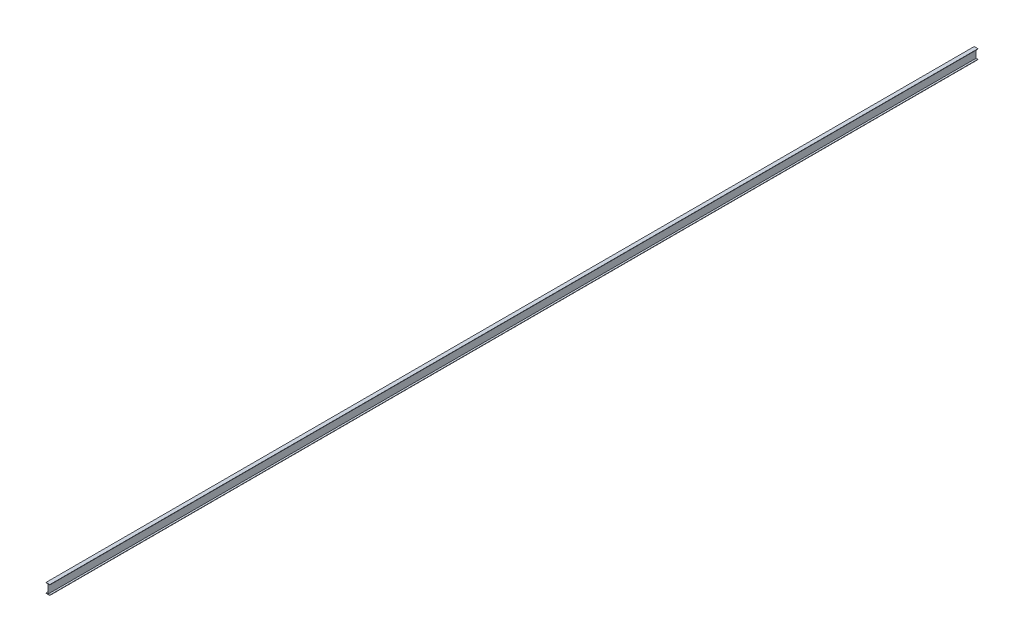
from build123d import *

# Parameters (mm, degrees)
BOSS_EXTRUDE1_DEPTH = 49152


with BuildPart() as part:
    # Sketch1 → Boss-Extrude1 (new body)
    with BuildSketch(Plane.XY):
        Polygon((100, 0), (100, 16), (5.1, 16), (5.1, 484.000003206), (100, 484.0000061), (100, 500), (-100, 500), (-100, 484), (-5.099618, 484.000002894), (-5.099618, 16), (-100, 16), (-100, 0), align=None)
    extrude(amount=BOSS_EXTRUDE1_DEPTH)


solid = part.part
